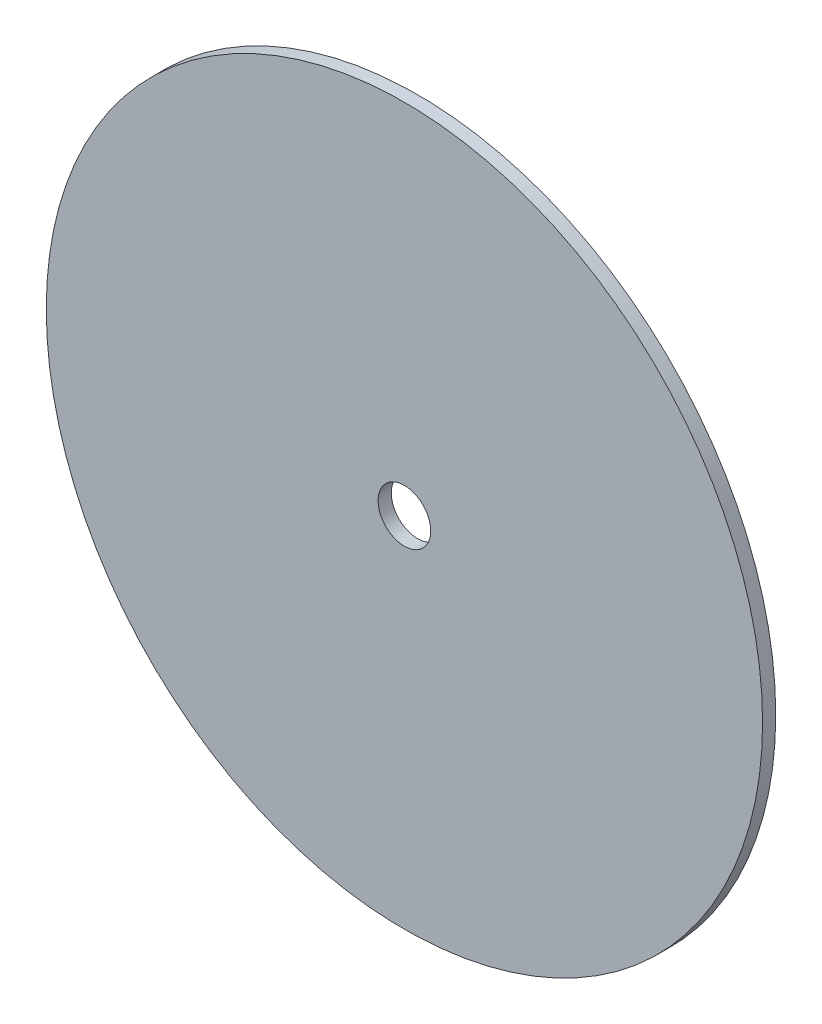
from build123d import *

# Parameters (mm, degrees)
SKETCH1_R           = 43.18
SKETCH1_R_2         = 3.175
BOSS_EXTRUDE1_DEPTH = 1.5875


with BuildPart() as part:
    # Sketch1 → Boss-Extrude1 (new body)
    with BuildSketch(Plane.XY):
        Circle(SKETCH1_R)
        Circle(SKETCH1_R_2, mode=Mode.SUBTRACT)
    extrude(amount=BOSS_EXTRUDE1_DEPTH)


solid = part.part
